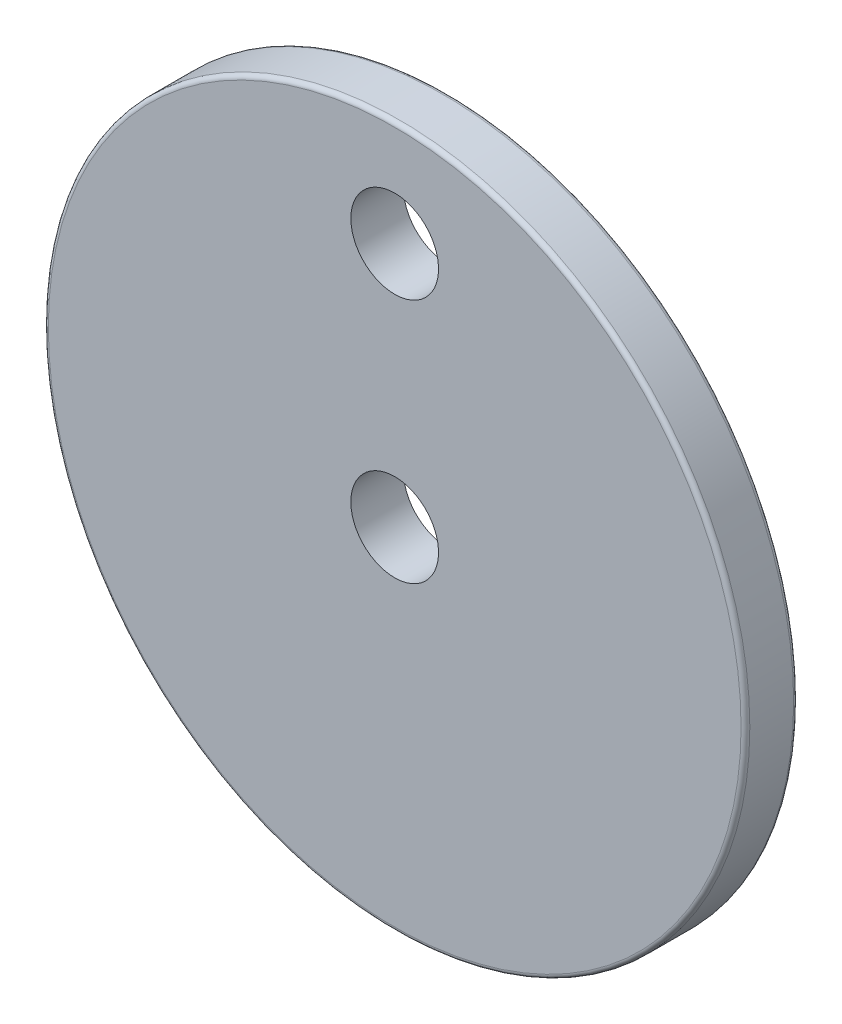
from build123d import *

# Parameters (mm, degrees)
SKETCH1_R           = 508
SKETCH1_R_2         = 63.5
BOSS_EXTRUDE1_DEPTH = 38.1
FILLET1_R           = 6.35


with BuildPart() as part:
    # Sketch1 → Boss-Extrude1 (new, symmetric)
    with BuildSketch(Plane.XY):
        with Locations(Location((0, 0, 0), (0, 0, 180))):
            Circle(SKETCH1_R)
        with Locations(Location((0, 0, 0), (0, 0, 180))):
            Circle(SKETCH1_R_2, mode=Mode.SUBTRACT)
        with Locations(Location((0, 355.6, 0), (0, 0, 180))):
            Circle(SKETCH1_R_2, mode=Mode.SUBTRACT)
    extrude(amount=BOSS_EXTRUDE1_DEPTH, both=True)

    # Fillet1
    fillet1_edges = [part.edges().sort_by_distance(p)[0] for p in [
        (508, 0, -38.1),
        (508, 0, 38.1),
    ]]
    fillet(fillet1_edges, radius=FILLET1_R)


solid = part.part
